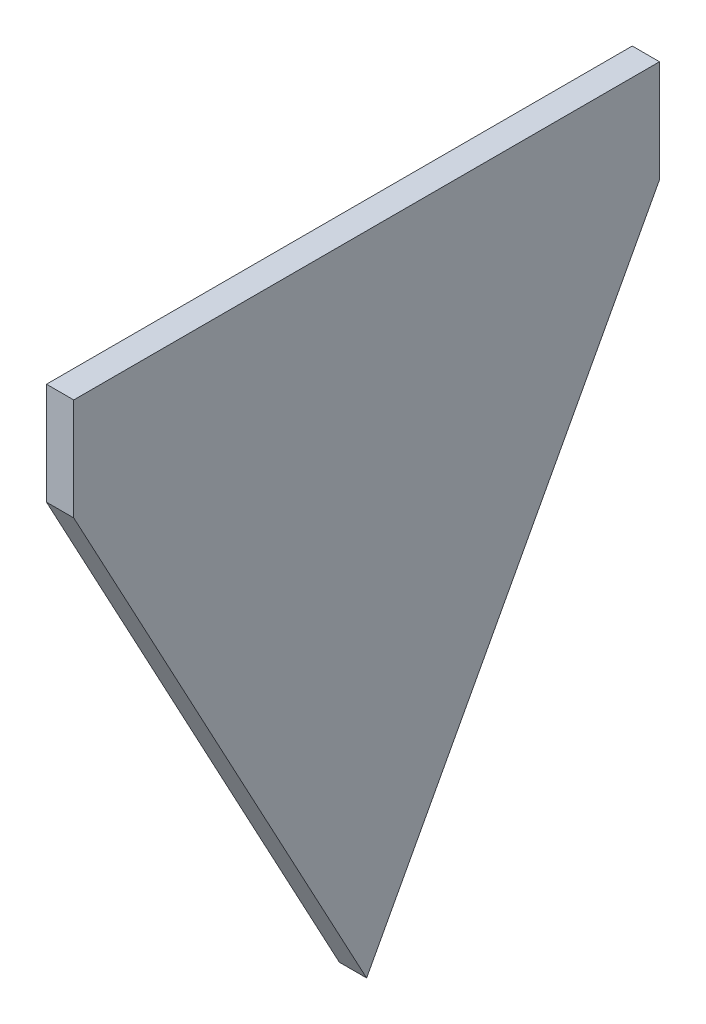
from build123d import *

# Parameters (mm, degrees)
BOSS_EXTRUDE1_DEPTH = 4


with BuildPart() as part:
    # Sketch1 → Boss-Extrude1 (new body)
    with BuildSketch(Plane(origin=(0, 0, 0), x_dir=(0, 0, -1), z_dir=(1, 0, 0))):
        Polygon((-43, 47.5), (43, 47.5), (43, 32.5), (0, -47.5), (-43, 32.5), align=None)
    extrude(amount=BOSS_EXTRUDE1_DEPTH)


solid = part.part
